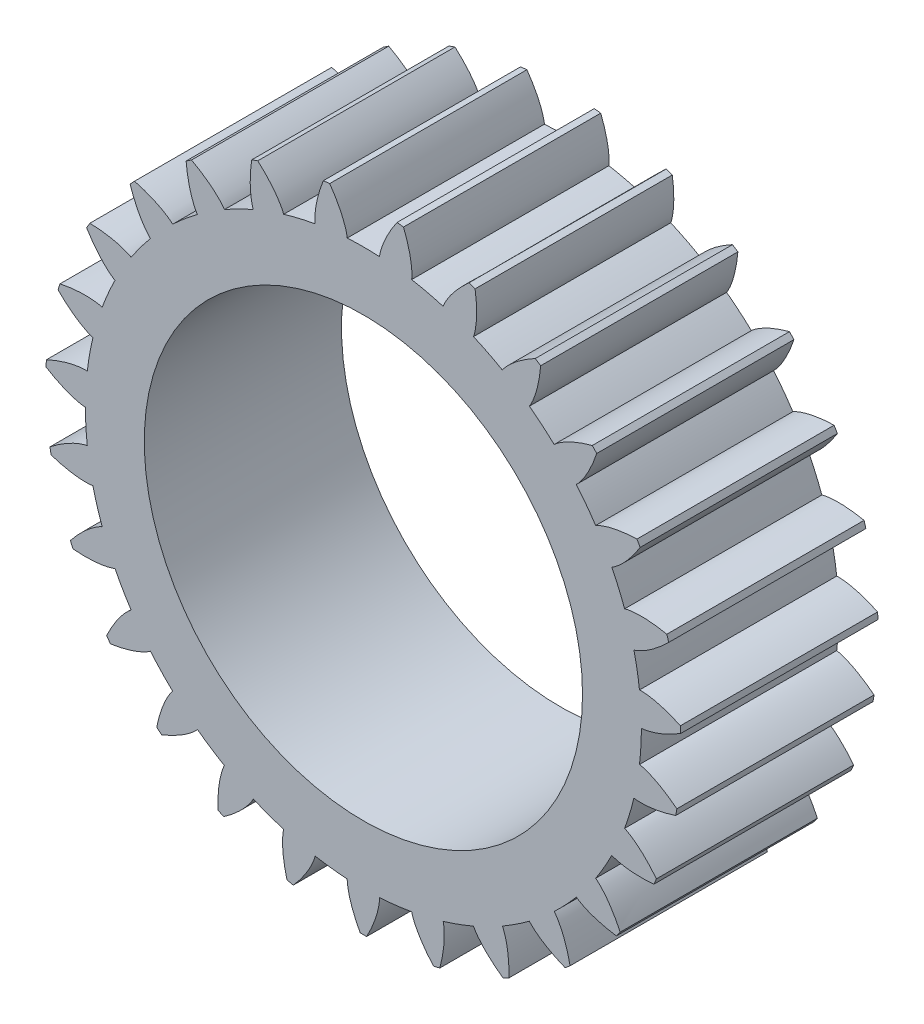
from build123d import *

# Parameters (mm, degrees)
BOSS_EXTRUDE1_DEPTH       = 20
CIRPATTERN1_COUNT         = 27
CIRPATTERN1_COPY_1_DEPTH  = 20
CIRPATTERN1_COPY_2_DEPTH  = 20
CIRPATTERN1_COPY_3_DEPTH  = 20
CIRPATTERN1_COPY_4_DEPTH  = 20
CIRPATTERN1_COPY_5_DEPTH  = 20
CIRPATTERN1_COPY_6_DEPTH  = 20
CIRPATTERN1_COPY_7_DEPTH  = 20
CIRPATTERN1_COPY_8_DEPTH  = 20
CIRPATTERN1_COPY_9_DEPTH  = 20
CIRPATTERN1_COPY_10_DEPTH = 20
CIRPATTERN1_COPY_11_DEPTH = 20
CIRPATTERN1_COPY_12_DEPTH = 20
CIRPATTERN1_COPY_13_DEPTH = 20
CIRPATTERN1_COPY_14_DEPTH = 20
CIRPATTERN1_COPY_15_DEPTH = 20
CIRPATTERN1_COPY_16_DEPTH = 20
CIRPATTERN1_COPY_17_DEPTH = 20
CIRPATTERN1_COPY_18_DEPTH = 20
CIRPATTERN1_COPY_19_DEPTH = 20
CIRPATTERN1_COPY_20_DEPTH = 20
CIRPATTERN1_COPY_21_DEPTH = 20
CIRPATTERN1_COPY_22_DEPTH = 20
CIRPATTERN1_COPY_23_DEPTH = 20
CIRPATTERN1_COPY_24_DEPTH = 20
CIRPATTERN1_COPY_25_DEPTH = 20
CIRPATTERN1_COPY_26_DEPTH = 20


with BuildPart() as part:
    # Sketch1 → Boss-Extrude1 (new body)
    with BuildSketch(Plane.XY):
        with BuildLine():
            Line((32.167707322, 1.873555598), (22.184625739, 1.292107309))
            ThreePointArc((22.184625739, 1.292107309), (22.222222222, 0), (22.184625739, -1.292107309))
            Line((22.184625739, -1.292107309), (28.143084288, -1.639148))
            ThreePointArc((28.143084288, -1.639148), (28.178852517, -0.819920867), (28.190778624, 0))
            add(Edge.make_bspline(
                [(28.190778624, 0), (28.228011822, 0.001099352), (28.302347119, 0.005359489), (28.510106814, 0.028085755), (28.902186978, 0.099178096), (29.492938468, 0.255816254), (30.282386851, 0.542473156), (31.073920975, 0.908543843), (31.672306894, 1.236191616), (32.043325962, 1.458266099), (32.18511751, 1.545902912)],
                knots=[0, 0, 0, 0, 0, 0.002802036, 0.005604072, 0.015718253, 0.029959922, 0.048733674, 0.068727069, 0.081271386, 0.081271386, 0.081271386, 0.081271386, 0.081271386], degree=4))
            ThreePointArc((32.18511751, 1.545902912), (32.176829475, 1.709751416), (32.167707322, 1.873555598))
        make_face()
    boss_extrude1 = extrude(amount=BOSS_EXTRUDE1_DEPTH)

    # Mirror1: Boss-Extrude1 across plane
    add(boss_extrude1.mirror(Plane(origin=(0, 0, 20), x_dir=(0, 0, 1), z_dir=(-0.05814482891047642, 0.9983081582712682, 0))))

    # CirPattern1: Boss-Extrude1 ×27 about axis
    cirpattern1_axis = Axis((0, 0, 20), (0, 0, -1))
    for i in range(1, CIRPATTERN1_COUNT):
        add(boss_extrude1.rotate(cirpattern1_axis, i * 360 / CIRPATTERN1_COUNT))

    # CirPattern1 copy 1 sketch → CirPattern1 copy 1 (add)
    with BuildSketch(Plane(origin=(0, 0, 0), x_dir=(0.993238357741943, -0.11609291412522904, 0), z_dir=(0, 0, 1))):
        with BuildLine():
            Line((32.167707322, -1.873555598), (22.184625739, -1.292107309))
            ThreePointArc((22.184625739, -1.292107309), (22.222222222, 0), (22.184625739, 1.292107309))
            Line((22.184625739, 1.292107309), (28.143084288, 1.639148))
            ThreePointArc((28.143084288, 1.639148), (28.178852517, 0.819920867), (28.190778624, 0))
            add(Edge.make_bspline(
                [(28.190778624, 0), (28.228011822, -0.001099352), (28.302347119, -0.005359489), (28.510106814, -0.028085755), (28.902186978, -0.099178096), (29.492938468, -0.255816254), (30.282386851, -0.542473156), (31.073920975, -0.908543843), (31.672306894, -1.236191616), (32.043325962, -1.458266099), (32.18511751, -1.545902912)],
                knots=[0, 0, 0, 0, 0, 0.002802036, 0.005604072, 0.015718253, 0.029959922, 0.048733674, 0.068727069, 0.081271386, 0.081271386, 0.081271386, 0.081271386, 0.081271386], degree=4))
            ThreePointArc((32.18511751, -1.545902912), (32.176829475, -1.709751416), (32.167707322, -1.873555598))
        make_face()
    extrude(amount=CIRPATTERN1_COPY_1_DEPTH)

    # CirPattern1 copy 2 sketch → CirPattern1 copy 2 (add)
    with BuildSketch(Plane(origin=(0, 0, 0), x_dir=(0.9396926207859088, -0.34202014332566755, 0), z_dir=(0, 0, 1))):
        with BuildLine():
            Line((32.167707322, -1.873555598), (22.184625739, -1.292107309))
            ThreePointArc((22.184625739, -1.292107309), (22.222222222, 0), (22.184625739, 1.292107309))
            Line((22.184625739, 1.292107309), (28.143084288, 1.639148))
            ThreePointArc((28.143084288, 1.639148), (28.178852517, 0.819920867), (28.190778624, 0))
            add(Edge.make_bspline(
                [(28.190778624, 0), (28.228011822, -0.001099352), (28.302347119, -0.005359489), (28.510106814, -0.028085755), (28.902186978, -0.099178096), (29.492938468, -0.255816254), (30.282386851, -0.542473156), (31.073920975, -0.908543843), (31.672306894, -1.236191616), (32.043325962, -1.458266099), (32.18511751, -1.545902912)],
                knots=[0, 0, 0, 0, 0, 0.002802036, 0.005604072, 0.015718253, 0.029959922, 0.048733674, 0.068727069, 0.081271386, 0.081271386, 0.081271386, 0.081271386, 0.081271386], degree=4))
            ThreePointArc((32.18511751, -1.545902912), (32.176829475, -1.709751416), (32.167707322, -1.873555598))
        make_face()
    extrude(amount=CIRPATTERN1_COPY_2_DEPTH)

    # CirPattern1 copy 3 sketch → CirPattern1 copy 3 (add)
    with BuildSketch(Plane(origin=(0, 0, 0), x_dir=(0.835487811412937, -0.5495089780708049, 0), z_dir=(0, 0, 1))):
        with BuildLine():
            Line((32.167707322, -1.873555598), (22.184625739, -1.292107309))
            ThreePointArc((22.184625739, -1.292107309), (22.222222222, 0), (22.184625739, 1.292107309))
            Line((22.184625739, 1.292107309), (28.143084288, 1.639148))
            ThreePointArc((28.143084288, 1.639148), (28.178852517, 0.819920867), (28.190778624, 0))
            add(Edge.make_bspline(
                [(28.190778624, 0), (28.228011822, -0.001099352), (28.302347119, -0.005359489), (28.510106814, -0.028085755), (28.902186978, -0.099178096), (29.492938468, -0.255816254), (30.282386851, -0.542473156), (31.073920975, -0.908543843), (31.672306894, -1.236191616), (32.043325962, -1.458266099), (32.18511751, -1.545902912)],
                knots=[0, 0, 0, 0, 0, 0.002802036, 0.005604072, 0.015718253, 0.029959922, 0.048733674, 0.068727069, 0.081271386, 0.081271386, 0.081271386, 0.081271386, 0.081271386], degree=4))
            ThreePointArc((32.18511751, -1.545902912), (32.176829475, -1.709751416), (32.167707322, -1.873555598))
        make_face()
    extrude(amount=CIRPATTERN1_COPY_3_DEPTH)

    # CirPattern1 copy 4 sketch → CirPattern1 copy 4 (add)
    with BuildSketch(Plane(origin=(0, 0, 0), x_dir=(0.6862416378687345, -0.7273736415730477, 0), z_dir=(0, 0, 1))):
        with BuildLine():
            Line((32.167707322, -1.873555598), (22.184625739, -1.292107309))
            ThreePointArc((22.184625739, -1.292107309), (22.222222222, 0), (22.184625739, 1.292107309))
            Line((22.184625739, 1.292107309), (28.143084288, 1.639148))
            ThreePointArc((28.143084288, 1.639148), (28.178852517, 0.819920867), (28.190778624, 0))
            add(Edge.make_bspline(
                [(28.190778624, 0), (28.228011822, -0.001099352), (28.302347119, -0.005359489), (28.510106814, -0.028085755), (28.902186978, -0.099178096), (29.492938468, -0.255816254), (30.282386851, -0.542473156), (31.073920975, -0.908543843), (31.672306894, -1.236191616), (32.043325962, -1.458266099), (32.18511751, -1.545902912)],
                knots=[0, 0, 0, 0, 0, 0.002802036, 0.005604072, 0.015718253, 0.029959922, 0.048733674, 0.068727069, 0.081271386, 0.081271386, 0.081271386, 0.081271386, 0.081271386], degree=4))
            ThreePointArc((32.18511751, -1.545902912), (32.176829475, -1.709751416), (32.167707322, -1.873555598))
        make_face()
    extrude(amount=CIRPATTERN1_COPY_4_DEPTH)

    # CirPattern1 copy 5 sketch → CirPattern1 copy 5 (add)
    with BuildSketch(Plane(origin=(0, 0, 0), x_dir=(0.5000000000000009, -0.866025403784438, 0), z_dir=(0, 0, 1))):
        with BuildLine():
            Line((32.167707322, -1.873555598), (22.184625739, -1.292107309))
            ThreePointArc((22.184625739, -1.292107309), (22.222222222, 0), (22.184625739, 1.292107309))
            Line((22.184625739, 1.292107309), (28.143084288, 1.639148))
            ThreePointArc((28.143084288, 1.639148), (28.178852517, 0.819920867), (28.190778624, 0))
            add(Edge.make_bspline(
                [(28.190778624, 0), (28.228011822, -0.001099352), (28.302347119, -0.005359489), (28.510106814, -0.028085755), (28.902186978, -0.099178096), (29.492938468, -0.255816254), (30.282386851, -0.542473156), (31.073920975, -0.908543843), (31.672306894, -1.236191616), (32.043325962, -1.458266099), (32.18511751, -1.545902912)],
                knots=[0, 0, 0, 0, 0, 0.002802036, 0.005604072, 0.015718253, 0.029959922, 0.048733674, 0.068727069, 0.081271386, 0.081271386, 0.081271386, 0.081271386, 0.081271386], degree=4))
            ThreePointArc((32.18511751, -1.545902912), (32.176829475, -1.709751416), (32.167707322, -1.873555598))
        make_face()
    extrude(amount=CIRPATTERN1_COPY_5_DEPTH)

    # CirPattern1 copy 6 sketch → CirPattern1 copy 6 (add)
    with BuildSketch(Plane(origin=(0, 0, 0), x_dir=(0.2868032327110914, -0.9579895123154885, 0), z_dir=(0, 0, 1))):
        with BuildLine():
            Line((32.167707322, -1.873555598), (22.184625739, -1.292107309))
            ThreePointArc((22.184625739, -1.292107309), (22.222222222, 0), (22.184625739, 1.292107309))
            Line((22.184625739, 1.292107309), (28.143084288, 1.639148))
            ThreePointArc((28.143084288, 1.639148), (28.178852517, 0.819920867), (28.190778624, 0))
            add(Edge.make_bspline(
                [(28.190778624, 0), (28.228011822, -0.001099352), (28.302347119, -0.005359489), (28.510106814, -0.028085755), (28.902186978, -0.099178096), (29.492938468, -0.255816254), (30.282386851, -0.542473156), (31.073920975, -0.908543843), (31.672306894, -1.236191616), (32.043325962, -1.458266099), (32.18511751, -1.545902912)],
                knots=[0, 0, 0, 0, 0, 0.002802036, 0.005604072, 0.015718253, 0.029959922, 0.048733674, 0.068727069, 0.081271386, 0.081271386, 0.081271386, 0.081271386, 0.081271386], degree=4))
            ThreePointArc((32.18511751, -1.545902912), (32.176829475, -1.709751416), (32.167707322, -1.873555598))
        make_face()
    extrude(amount=CIRPATTERN1_COPY_6_DEPTH)

    # CirPattern1 copy 7 sketch → CirPattern1 copy 7 (add)
    with BuildSketch(Plane(origin=(0, 0, 0), x_dir=(0.058144828910476835, -0.9983081582712681, 0), z_dir=(0, 0, 1))):
        with BuildLine():
            Line((32.167707322, -1.873555598), (22.184625739, -1.292107309))
            ThreePointArc((22.184625739, -1.292107309), (22.222222222, 0), (22.184625739, 1.292107309))
            Line((22.184625739, 1.292107309), (28.143084288, 1.639148))
            ThreePointArc((28.143084288, 1.639148), (28.178852517, 0.819920867), (28.190778624, 0))
            add(Edge.make_bspline(
                [(28.190778624, 0), (28.228011822, -0.001099352), (28.302347119, -0.005359489), (28.510106814, -0.028085755), (28.902186978, -0.099178096), (29.492938468, -0.255816254), (30.282386851, -0.542473156), (31.073920975, -0.908543843), (31.672306894, -1.236191616), (32.043325962, -1.458266099), (32.18511751, -1.545902912)],
                knots=[0, 0, 0, 0, 0, 0.002802036, 0.005604072, 0.015718253, 0.029959922, 0.048733674, 0.068727069, 0.081271386, 0.081271386, 0.081271386, 0.081271386, 0.081271386], degree=4))
            ThreePointArc((32.18511751, -1.545902912), (32.176829475, -1.709751416), (32.167707322, -1.873555598))
        make_face()
    extrude(amount=CIRPATTERN1_COPY_7_DEPTH)

    # CirPattern1 copy 8 sketch → CirPattern1 copy 8 (add)
    with BuildSketch(Plane(origin=(0, 0, 0), x_dir=(-0.17364817766692908, -0.9848077530122082, 0), z_dir=(0, 0, 1))):
        with BuildLine():
            Line((32.167707322, -1.873555598), (22.184625739, -1.292107309))
            ThreePointArc((22.184625739, -1.292107309), (22.222222222, 0), (22.184625739, 1.292107309))
            Line((22.184625739, 1.292107309), (28.143084288, 1.639148))
            ThreePointArc((28.143084288, 1.639148), (28.178852517, 0.819920867), (28.190778624, 0))
            add(Edge.make_bspline(
                [(28.190778624, 0), (28.228011822, -0.001099352), (28.302347119, -0.005359489), (28.510106814, -0.028085755), (28.902186978, -0.099178096), (29.492938468, -0.255816254), (30.282386851, -0.542473156), (31.073920975, -0.908543843), (31.672306894, -1.236191616), (32.043325962, -1.458266099), (32.18511751, -1.545902912)],
                knots=[0, 0, 0, 0, 0, 0.002802036, 0.005604072, 0.015718253, 0.029959922, 0.048733674, 0.068727069, 0.081271386, 0.081271386, 0.081271386, 0.081271386, 0.081271386], degree=4))
            ThreePointArc((32.18511751, -1.545902912), (32.176829475, -1.709751416), (32.167707322, -1.873555598))
        make_face()
    extrude(amount=CIRPATTERN1_COPY_8_DEPTH)

    # CirPattern1 copy 9 sketch → CirPattern1 copy 9 (add)
    with BuildSketch(Plane(origin=(0, 0, 0), x_dir=(-0.3960797660391555, -0.9182161068802744, 0), z_dir=(0, 0, 1))):
        with BuildLine():
            Line((32.167707322, -1.873555598), (22.184625739, -1.292107309))
            ThreePointArc((22.184625739, -1.292107309), (22.222222222, 0), (22.184625739, 1.292107309))
            Line((22.184625739, 1.292107309), (28.143084288, 1.639148))
            ThreePointArc((28.143084288, 1.639148), (28.178852517, 0.819920867), (28.190778624, 0))
            add(Edge.make_bspline(
                [(28.190778624, 0), (28.228011822, -0.001099352), (28.302347119, -0.005359489), (28.510106814, -0.028085755), (28.902186978, -0.099178096), (29.492938468, -0.255816254), (30.282386851, -0.542473156), (31.073920975, -0.908543843), (31.672306894, -1.236191616), (32.043325962, -1.458266099), (32.18511751, -1.545902912)],
                knots=[0, 0, 0, 0, 0, 0.002802036, 0.005604072, 0.015718253, 0.029959922, 0.048733674, 0.068727069, 0.081271386, 0.081271386, 0.081271386, 0.081271386, 0.081271386], degree=4))
            ThreePointArc((32.18511751, -1.545902912), (32.176829475, -1.709751416), (32.167707322, -1.873555598))
        make_face()
    extrude(amount=CIRPATTERN1_COPY_9_DEPTH)

    # CirPattern1 copy 10 sketch → CirPattern1 copy 10 (add)
    with BuildSketch(Plane(origin=(0, 0, 0), x_dir=(-0.5971585917027854, -0.8021231927550443, 0), z_dir=(0, 0, 1))):
        with BuildLine():
            Line((32.167707322, -1.873555598), (22.184625739, -1.292107309))
            ThreePointArc((22.184625739, -1.292107309), (22.222222222, 0), (22.184625739, 1.292107309))
            Line((22.184625739, 1.292107309), (28.143084288, 1.639148))
            ThreePointArc((28.143084288, 1.639148), (28.178852517, 0.819920867), (28.190778624, 0))
            add(Edge.make_bspline(
                [(28.190778624, 0), (28.228011822, -0.001099352), (28.302347119, -0.005359489), (28.510106814, -0.028085755), (28.902186978, -0.099178096), (29.492938468, -0.255816254), (30.282386851, -0.542473156), (31.073920975, -0.908543843), (31.672306894, -1.236191616), (32.043325962, -1.458266099), (32.18511751, -1.545902912)],
                knots=[0, 0, 0, 0, 0, 0.002802036, 0.005604072, 0.015718253, 0.029959922, 0.048733674, 0.068727069, 0.081271386, 0.081271386, 0.081271386, 0.081271386, 0.081271386], degree=4))
            ThreePointArc((32.18511751, -1.545902912), (32.176829475, -1.709751416), (32.167707322, -1.873555598))
        make_face()
    extrude(amount=CIRPATTERN1_COPY_10_DEPTH)

    # CirPattern1 copy 11 sketch → CirPattern1 copy 11 (add)
    with BuildSketch(Plane(origin=(0, 0, 0), x_dir=(-0.7660444431189775, -0.64278760968654, 0), z_dir=(0, 0, 1))):
        with BuildLine():
            Line((32.167707322, -1.873555598), (22.184625739, -1.292107309))
            ThreePointArc((22.184625739, -1.292107309), (22.222222222, 0), (22.184625739, 1.292107309))
            Line((22.184625739, 1.292107309), (28.143084288, 1.639148))
            ThreePointArc((28.143084288, 1.639148), (28.178852517, 0.819920867), (28.190778624, 0))
            add(Edge.make_bspline(
                [(28.190778624, 0), (28.228011822, -0.001099352), (28.302347119, -0.005359489), (28.510106814, -0.028085755), (28.902186978, -0.099178096), (29.492938468, -0.255816254), (30.282386851, -0.542473156), (31.073920975, -0.908543843), (31.672306894, -1.236191616), (32.043325962, -1.458266099), (32.18511751, -1.545902912)],
                knots=[0, 0, 0, 0, 0, 0.002802036, 0.005604072, 0.015718253, 0.029959922, 0.048733674, 0.068727069, 0.081271386, 0.081271386, 0.081271386, 0.081271386, 0.081271386], degree=4))
            ThreePointArc((32.18511751, -1.545902912), (32.176829475, -1.709751416), (32.167707322, -1.873555598))
        make_face()
    extrude(amount=CIRPATTERN1_COPY_11_DEPTH)

    # CirPattern1 copy 12 sketch → CirPattern1 copy 12 (add)
    with BuildSketch(Plane(origin=(0, 0, 0), x_dir=(-0.8936326403234116, -0.4487991802004634, 0), z_dir=(0, 0, 1))):
        with BuildLine():
            Line((32.167707322, -1.873555598), (22.184625739, -1.292107309))
            ThreePointArc((22.184625739, -1.292107309), (22.222222222, 0), (22.184625739, 1.292107309))
            Line((22.184625739, 1.292107309), (28.143084288, 1.639148))
            ThreePointArc((28.143084288, 1.639148), (28.178852517, 0.819920867), (28.190778624, 0))
            add(Edge.make_bspline(
                [(28.190778624, 0), (28.228011822, -0.001099352), (28.302347119, -0.005359489), (28.510106814, -0.028085755), (28.902186978, -0.099178096), (29.492938468, -0.255816254), (30.282386851, -0.542473156), (31.073920975, -0.908543843), (31.672306894, -1.236191616), (32.043325962, -1.458266099), (32.18511751, -1.545902912)],
                knots=[0, 0, 0, 0, 0, 0.002802036, 0.005604072, 0.015718253, 0.029959922, 0.048733674, 0.068727069, 0.081271386, 0.081271386, 0.081271386, 0.081271386, 0.081271386], degree=4))
            ThreePointArc((32.18511751, -1.545902912), (32.176829475, -1.709751416), (32.167707322, -1.873555598))
        make_face()
    extrude(amount=CIRPATTERN1_COPY_12_DEPTH)

    # CirPattern1 copy 13 sketch → CirPattern1 copy 13 (add)
    with BuildSketch(Plane(origin=(0, 0, 0), x_dir=(-0.9730448705798236, -0.23061587074244103, 0), z_dir=(0, 0, 1))):
        with BuildLine():
            Line((32.167707322, -1.873555598), (22.184625739, -1.292107309))
            ThreePointArc((22.184625739, -1.292107309), (22.222222222, 0), (22.184625739, 1.292107309))
            Line((22.184625739, 1.292107309), (28.143084288, 1.639148))
            ThreePointArc((28.143084288, 1.639148), (28.178852517, 0.819920867), (28.190778624, 0))
            add(Edge.make_bspline(
                [(28.190778624, 0), (28.228011822, -0.001099352), (28.302347119, -0.005359489), (28.510106814, -0.028085755), (28.902186978, -0.099178096), (29.492938468, -0.255816254), (30.282386851, -0.542473156), (31.073920975, -0.908543843), (31.672306894, -1.236191616), (32.043325962, -1.458266099), (32.18511751, -1.545902912)],
                knots=[0, 0, 0, 0, 0, 0.002802036, 0.005604072, 0.015718253, 0.029959922, 0.048733674, 0.068727069, 0.081271386, 0.081271386, 0.081271386, 0.081271386, 0.081271386], degree=4))
            ThreePointArc((32.18511751, -1.545902912), (32.176829475, -1.709751416), (32.167707322, -1.873555598))
        make_face()
    extrude(amount=CIRPATTERN1_COPY_13_DEPTH)

    # CirPattern1 copy 14 sketch → CirPattern1 copy 14 (add)
    with BuildSketch(Plane(origin=(0, 0, 0), x_dir=(-1, 0, 0), z_dir=(0, 0, 1))):
        with BuildLine():
            Line((32.167707322, -1.873555598), (22.184625739, -1.292107309))
            ThreePointArc((22.184625739, -1.292107309), (22.222222222, 0), (22.184625739, 1.292107309))
            Line((22.184625739, 1.292107309), (28.143084288, 1.639148))
            ThreePointArc((28.143084288, 1.639148), (28.178852517, 0.819920867), (28.190778624, 0))
            add(Edge.make_bspline(
                [(28.190778624, 0), (28.228011822, -0.001099352), (28.302347119, -0.005359489), (28.510106814, -0.028085755), (28.902186978, -0.099178096), (29.492938468, -0.255816254), (30.282386851, -0.542473156), (31.073920975, -0.908543843), (31.672306894, -1.236191616), (32.043325962, -1.458266099), (32.18511751, -1.545902912)],
                knots=[0, 0, 0, 0, 0, 0.002802036, 0.005604072, 0.015718253, 0.029959922, 0.048733674, 0.068727069, 0.081271386, 0.081271386, 0.081271386, 0.081271386, 0.081271386], degree=4))
            ThreePointArc((32.18511751, -1.545902912), (32.176829475, -1.709751416), (32.167707322, -1.873555598))
        make_face()
    extrude(amount=CIRPATTERN1_COPY_14_DEPTH)

    # CirPattern1 copy 15 sketch → CirPattern1 copy 15 (add)
    with BuildSketch(Plane(origin=(0, 0, 0), x_dir=(-0.9730448705798241, 0.23061587074243894, 0), z_dir=(0, 0, 1))):
        with BuildLine():
            Line((32.167707322, -1.873555598), (22.184625739, -1.292107309))
            ThreePointArc((22.184625739, -1.292107309), (22.222222222, 0), (22.184625739, 1.292107309))
            Line((22.184625739, 1.292107309), (28.143084288, 1.639148))
            ThreePointArc((28.143084288, 1.639148), (28.178852517, 0.819920867), (28.190778624, 0))
            add(Edge.make_bspline(
                [(28.190778624, 0), (28.228011822, -0.001099352), (28.302347119, -0.005359489), (28.510106814, -0.028085755), (28.902186978, -0.099178096), (29.492938468, -0.255816254), (30.282386851, -0.542473156), (31.073920975, -0.908543843), (31.672306894, -1.236191616), (32.043325962, -1.458266099), (32.18511751, -1.545902912)],
                knots=[0, 0, 0, 0, 0, 0.002802036, 0.005604072, 0.015718253, 0.029959922, 0.048733674, 0.068727069, 0.081271386, 0.081271386, 0.081271386, 0.081271386, 0.081271386], degree=4))
            ThreePointArc((32.18511751, -1.545902912), (32.176829475, -1.709751416), (32.167707322, -1.873555598))
        make_face()
    extrude(amount=CIRPATTERN1_COPY_15_DEPTH)

    # CirPattern1 copy 16 sketch → CirPattern1 copy 16 (add)
    with BuildSketch(Plane(origin=(0, 0, 0), x_dir=(-0.8936326403234128, 0.4487991802004611, 0), z_dir=(0, 0, 1))):
        with BuildLine():
            Line((32.167707322, -1.873555598), (22.184625739, -1.292107309))
            ThreePointArc((22.184625739, -1.292107309), (22.222222222, 0), (22.184625739, 1.292107309))
            Line((22.184625739, 1.292107309), (28.143084288, 1.639148))
            ThreePointArc((28.143084288, 1.639148), (28.178852517, 0.819920867), (28.190778624, 0))
            add(Edge.make_bspline(
                [(28.190778624, 0), (28.228011822, -0.001099352), (28.302347119, -0.005359489), (28.510106814, -0.028085755), (28.902186978, -0.099178096), (29.492938468, -0.255816254), (30.282386851, -0.542473156), (31.073920975, -0.908543843), (31.672306894, -1.236191616), (32.043325962, -1.458266099), (32.18511751, -1.545902912)],
                knots=[0, 0, 0, 0, 0, 0.002802036, 0.005604072, 0.015718253, 0.029959922, 0.048733674, 0.068727069, 0.081271386, 0.081271386, 0.081271386, 0.081271386, 0.081271386], degree=4))
            ThreePointArc((32.18511751, -1.545902912), (32.176829475, -1.709751416), (32.167707322, -1.873555598))
        make_face()
    extrude(amount=CIRPATTERN1_COPY_16_DEPTH)

    # CirPattern1 copy 17 sketch → CirPattern1 copy 17 (add)
    with BuildSketch(Plane(origin=(0, 0, 0), x_dir=(-0.7660444431189786, 0.6427876096865387, 0), z_dir=(0, 0, 1))):
        with BuildLine():
            Line((32.167707322, -1.873555598), (22.184625739, -1.292107309))
            ThreePointArc((22.184625739, -1.292107309), (22.222222222, 0), (22.184625739, 1.292107309))
            Line((22.184625739, 1.292107309), (28.143084288, 1.639148))
            ThreePointArc((28.143084288, 1.639148), (28.178852517, 0.819920867), (28.190778624, 0))
            add(Edge.make_bspline(
                [(28.190778624, 0), (28.228011822, -0.001099352), (28.302347119, -0.005359489), (28.510106814, -0.028085755), (28.902186978, -0.099178096), (29.492938468, -0.255816254), (30.282386851, -0.542473156), (31.073920975, -0.908543843), (31.672306894, -1.236191616), (32.043325962, -1.458266099), (32.18511751, -1.545902912)],
                knots=[0, 0, 0, 0, 0, 0.002802036, 0.005604072, 0.015718253, 0.029959922, 0.048733674, 0.068727069, 0.081271386, 0.081271386, 0.081271386, 0.081271386, 0.081271386], degree=4))
            ThreePointArc((32.18511751, -1.545902912), (32.176829475, -1.709751416), (32.167707322, -1.873555598))
        make_face()
    extrude(amount=CIRPATTERN1_COPY_17_DEPTH)

    # CirPattern1 copy 18 sketch → CirPattern1 copy 18 (add)
    with BuildSketch(Plane(origin=(0, 0, 0), x_dir=(-0.5971585917027875, 0.8021231927550426, 0), z_dir=(0, 0, 1))):
        with BuildLine():
            Line((32.167707322, -1.873555598), (22.184625739, -1.292107309))
            ThreePointArc((22.184625739, -1.292107309), (22.222222222, 0), (22.184625739, 1.292107309))
            Line((22.184625739, 1.292107309), (28.143084288, 1.639148))
            ThreePointArc((28.143084288, 1.639148), (28.178852517, 0.819920867), (28.190778624, 0))
            add(Edge.make_bspline(
                [(28.190778624, 0), (28.228011822, -0.001099352), (28.302347119, -0.005359489), (28.510106814, -0.028085755), (28.902186978, -0.099178096), (29.492938468, -0.255816254), (30.282386851, -0.542473156), (31.073920975, -0.908543843), (31.672306894, -1.236191616), (32.043325962, -1.458266099), (32.18511751, -1.545902912)],
                knots=[0, 0, 0, 0, 0, 0.002802036, 0.005604072, 0.015718253, 0.029959922, 0.048733674, 0.068727069, 0.081271386, 0.081271386, 0.081271386, 0.081271386, 0.081271386], degree=4))
            ThreePointArc((32.18511751, -1.545902912), (32.176829475, -1.709751416), (32.167707322, -1.873555598))
        make_face()
    extrude(amount=CIRPATTERN1_COPY_18_DEPTH)

    # CirPattern1 copy 19 sketch → CirPattern1 copy 19 (add)
    with BuildSketch(Plane(origin=(0, 0, 0), x_dir=(-0.39607976603915745, 0.9182161068802737, 0), z_dir=(0, 0, 1))):
        with BuildLine():
            Line((32.167707322, -1.873555598), (22.184625739, -1.292107309))
            ThreePointArc((22.184625739, -1.292107309), (22.222222222, 0), (22.184625739, 1.292107309))
            Line((22.184625739, 1.292107309), (28.143084288, 1.639148))
            ThreePointArc((28.143084288, 1.639148), (28.178852517, 0.819920867), (28.190778624, 0))
            add(Edge.make_bspline(
                [(28.190778624, 0), (28.228011822, -0.001099352), (28.302347119, -0.005359489), (28.510106814, -0.028085755), (28.902186978, -0.099178096), (29.492938468, -0.255816254), (30.282386851, -0.542473156), (31.073920975, -0.908543843), (31.672306894, -1.236191616), (32.043325962, -1.458266099), (32.18511751, -1.545902912)],
                knots=[0, 0, 0, 0, 0, 0.002802036, 0.005604072, 0.015718253, 0.029959922, 0.048733674, 0.068727069, 0.081271386, 0.081271386, 0.081271386, 0.081271386, 0.081271386], degree=4))
            ThreePointArc((32.18511751, -1.545902912), (32.176829475, -1.709751416), (32.167707322, -1.873555598))
        make_face()
    extrude(amount=CIRPATTERN1_COPY_19_DEPTH)

    # CirPattern1 copy 20 sketch → CirPattern1 copy 20 (add)
    with BuildSketch(Plane(origin=(0, 0, 0), x_dir=(-0.17364817766693103, 0.9848077530122079, 0), z_dir=(0, 0, 1))):
        with BuildLine():
            Line((32.167707322, -1.873555598), (22.184625739, -1.292107309))
            ThreePointArc((22.184625739, -1.292107309), (22.222222222, 0), (22.184625739, 1.292107309))
            Line((22.184625739, 1.292107309), (28.143084288, 1.639148))
            ThreePointArc((28.143084288, 1.639148), (28.178852517, 0.819920867), (28.190778624, 0))
            add(Edge.make_bspline(
                [(28.190778624, 0), (28.228011822, -0.001099352), (28.302347119, -0.005359489), (28.510106814, -0.028085755), (28.902186978, -0.099178096), (29.492938468, -0.255816254), (30.282386851, -0.542473156), (31.073920975, -0.908543843), (31.672306894, -1.236191616), (32.043325962, -1.458266099), (32.18511751, -1.545902912)],
                knots=[0, 0, 0, 0, 0, 0.002802036, 0.005604072, 0.015718253, 0.029959922, 0.048733674, 0.068727069, 0.081271386, 0.081271386, 0.081271386, 0.081271386, 0.081271386], degree=4))
            ThreePointArc((32.18511751, -1.545902912), (32.176829475, -1.709751416), (32.167707322, -1.873555598))
        make_face()
    extrude(amount=CIRPATTERN1_COPY_20_DEPTH)

    # CirPattern1 copy 21 sketch → CirPattern1 copy 21 (add)
    with BuildSketch(Plane(origin=(0, 0, 0), x_dir=(0.05814482891047426, 0.9983081582712683, 0), z_dir=(0, 0, 1))):
        with BuildLine():
            Line((32.167707322, -1.873555598), (22.184625739, -1.292107309))
            ThreePointArc((22.184625739, -1.292107309), (22.222222222, 0), (22.184625739, 1.292107309))
            Line((22.184625739, 1.292107309), (28.143084288, 1.639148))
            ThreePointArc((28.143084288, 1.639148), (28.178852517, 0.819920867), (28.190778624, 0))
            add(Edge.make_bspline(
                [(28.190778624, 0), (28.228011822, -0.001099352), (28.302347119, -0.005359489), (28.510106814, -0.028085755), (28.902186978, -0.099178096), (29.492938468, -0.255816254), (30.282386851, -0.542473156), (31.073920975, -0.908543843), (31.672306894, -1.236191616), (32.043325962, -1.458266099), (32.18511751, -1.545902912)],
                knots=[0, 0, 0, 0, 0, 0.002802036, 0.005604072, 0.015718253, 0.029959922, 0.048733674, 0.068727069, 0.081271386, 0.081271386, 0.081271386, 0.081271386, 0.081271386], degree=4))
            ThreePointArc((32.18511751, -1.545902912), (32.176829475, -1.709751416), (32.167707322, -1.873555598))
        make_face()
    extrude(amount=CIRPATTERN1_COPY_21_DEPTH)

    # CirPattern1 copy 22 sketch → CirPattern1 copy 22 (add)
    with BuildSketch(Plane(origin=(0, 0, 0), x_dir=(0.28680323271108954, 0.9579895123154889, 0), z_dir=(0, 0, 1))):
        with BuildLine():
            Line((32.167707322, -1.873555598), (22.184625739, -1.292107309))
            ThreePointArc((22.184625739, -1.292107309), (22.222222222, 0), (22.184625739, 1.292107309))
            Line((22.184625739, 1.292107309), (28.143084288, 1.639148))
            ThreePointArc((28.143084288, 1.639148), (28.178852517, 0.819920867), (28.190778624, 0))
            add(Edge.make_bspline(
                [(28.190778624, 0), (28.228011822, -0.001099352), (28.302347119, -0.005359489), (28.510106814, -0.028085755), (28.902186978, -0.099178096), (29.492938468, -0.255816254), (30.282386851, -0.542473156), (31.073920975, -0.908543843), (31.672306894, -1.236191616), (32.043325962, -1.458266099), (32.18511751, -1.545902912)],
                knots=[0, 0, 0, 0, 0, 0.002802036, 0.005604072, 0.015718253, 0.029959922, 0.048733674, 0.068727069, 0.081271386, 0.081271386, 0.081271386, 0.081271386, 0.081271386], degree=4))
            ThreePointArc((32.18511751, -1.545902912), (32.176829475, -1.709751416), (32.167707322, -1.873555598))
        make_face()
    extrude(amount=CIRPATTERN1_COPY_22_DEPTH)

    # CirPattern1 copy 23 sketch → CirPattern1 copy 23 (add)
    with BuildSketch(Plane(origin=(0, 0, 0), x_dir=(0.4999999999999995, 0.8660254037844389, 0), z_dir=(0, 0, 1))):
        with BuildLine():
            Line((32.167707322, -1.873555598), (22.184625739, -1.292107309))
            ThreePointArc((22.184625739, -1.292107309), (22.222222222, 0), (22.184625739, 1.292107309))
            Line((22.184625739, 1.292107309), (28.143084288, 1.639148))
            ThreePointArc((28.143084288, 1.639148), (28.178852517, 0.819920867), (28.190778624, 0))
            add(Edge.make_bspline(
                [(28.190778624, 0), (28.228011822, -0.001099352), (28.302347119, -0.005359489), (28.510106814, -0.028085755), (28.902186978, -0.099178096), (29.492938468, -0.255816254), (30.282386851, -0.542473156), (31.073920975, -0.908543843), (31.672306894, -1.236191616), (32.043325962, -1.458266099), (32.18511751, -1.545902912)],
                knots=[0, 0, 0, 0, 0, 0.002802036, 0.005604072, 0.015718253, 0.029959922, 0.048733674, 0.068727069, 0.081271386, 0.081271386, 0.081271386, 0.081271386, 0.081271386], degree=4))
            ThreePointArc((32.18511751, -1.545902912), (32.176829475, -1.709751416), (32.167707322, -1.873555598))
        make_face()
    extrude(amount=CIRPATTERN1_COPY_23_DEPTH)

    # CirPattern1 copy 24 sketch → CirPattern1 copy 24 (add)
    with BuildSketch(Plane(origin=(0, 0, 0), x_dir=(0.6862416378687325, 0.7273736415730496, 0), z_dir=(0, 0, 1))):
        with BuildLine():
            Line((32.167707322, -1.873555598), (22.184625739, -1.292107309))
            ThreePointArc((22.184625739, -1.292107309), (22.222222222, 0), (22.184625739, 1.292107309))
            Line((22.184625739, 1.292107309), (28.143084288, 1.639148))
            ThreePointArc((28.143084288, 1.639148), (28.178852517, 0.819920867), (28.190778624, 0))
            add(Edge.make_bspline(
                [(28.190778624, 0), (28.228011822, -0.001099352), (28.302347119, -0.005359489), (28.510106814, -0.028085755), (28.902186978, -0.099178096), (29.492938468, -0.255816254), (30.282386851, -0.542473156), (31.073920975, -0.908543843), (31.672306894, -1.236191616), (32.043325962, -1.458266099), (32.18511751, -1.545902912)],
                knots=[0, 0, 0, 0, 0, 0.002802036, 0.005604072, 0.015718253, 0.029959922, 0.048733674, 0.068727069, 0.081271386, 0.081271386, 0.081271386, 0.081271386, 0.081271386], degree=4))
            ThreePointArc((32.18511751, -1.545902912), (32.176829475, -1.709751416), (32.167707322, -1.873555598))
        make_face()
    extrude(amount=CIRPATTERN1_COPY_24_DEPTH)

    # CirPattern1 copy 25 sketch → CirPattern1 copy 25 (add)
    with BuildSketch(Plane(origin=(0, 0, 0), x_dir=(0.835487811412936, 0.5495089780708065, 0), z_dir=(0, 0, 1))):
        with BuildLine():
            Line((32.167707322, -1.873555598), (22.184625739, -1.292107309))
            ThreePointArc((22.184625739, -1.292107309), (22.222222222, 0), (22.184625739, 1.292107309))
            Line((22.184625739, 1.292107309), (28.143084288, 1.639148))
            ThreePointArc((28.143084288, 1.639148), (28.178852517, 0.819920867), (28.190778624, 0))
            add(Edge.make_bspline(
                [(28.190778624, 0), (28.228011822, -0.001099352), (28.302347119, -0.005359489), (28.510106814, -0.028085755), (28.902186978, -0.099178096), (29.492938468, -0.255816254), (30.282386851, -0.542473156), (31.073920975, -0.908543843), (31.672306894, -1.236191616), (32.043325962, -1.458266099), (32.18511751, -1.545902912)],
                knots=[0, 0, 0, 0, 0, 0.002802036, 0.005604072, 0.015718253, 0.029959922, 0.048733674, 0.068727069, 0.081271386, 0.081271386, 0.081271386, 0.081271386, 0.081271386], degree=4))
            ThreePointArc((32.18511751, -1.545902912), (32.176829475, -1.709751416), (32.167707322, -1.873555598))
        make_face()
    extrude(amount=CIRPATTERN1_COPY_25_DEPTH)

    # CirPattern1 copy 26 sketch → CirPattern1 copy 26 (add)
    with BuildSketch(Plane(origin=(0, 0, 0), x_dir=(0.9396926207859082, 0.34202014332566927, 0), z_dir=(0, 0, 1))):
        with BuildLine():
            Line((32.167707322, -1.873555598), (22.184625739, -1.292107309))
            ThreePointArc((22.184625739, -1.292107309), (22.222222222, 0), (22.184625739, 1.292107309))
            Line((22.184625739, 1.292107309), (28.143084288, 1.639148))
            ThreePointArc((28.143084288, 1.639148), (28.178852517, 0.819920867), (28.190778624, 0))
            add(Edge.make_bspline(
                [(28.190778624, 0), (28.228011822, -0.001099352), (28.302347119, -0.005359489), (28.510106814, -0.028085755), (28.902186978, -0.099178096), (29.492938468, -0.255816254), (30.282386851, -0.542473156), (31.073920975, -0.908543843), (31.672306894, -1.236191616), (32.043325962, -1.458266099), (32.18511751, -1.545902912)],
                knots=[0, 0, 0, 0, 0, 0.002802036, 0.005604072, 0.015718253, 0.029959922, 0.048733674, 0.068727069, 0.081271386, 0.081271386, 0.081271386, 0.081271386, 0.081271386], degree=4))
            ThreePointArc((32.18511751, -1.545902912), (32.176829475, -1.709751416), (32.167707322, -1.873555598))
        make_face()
    extrude(amount=CIRPATTERN1_COPY_26_DEPTH)


solid = part.part
